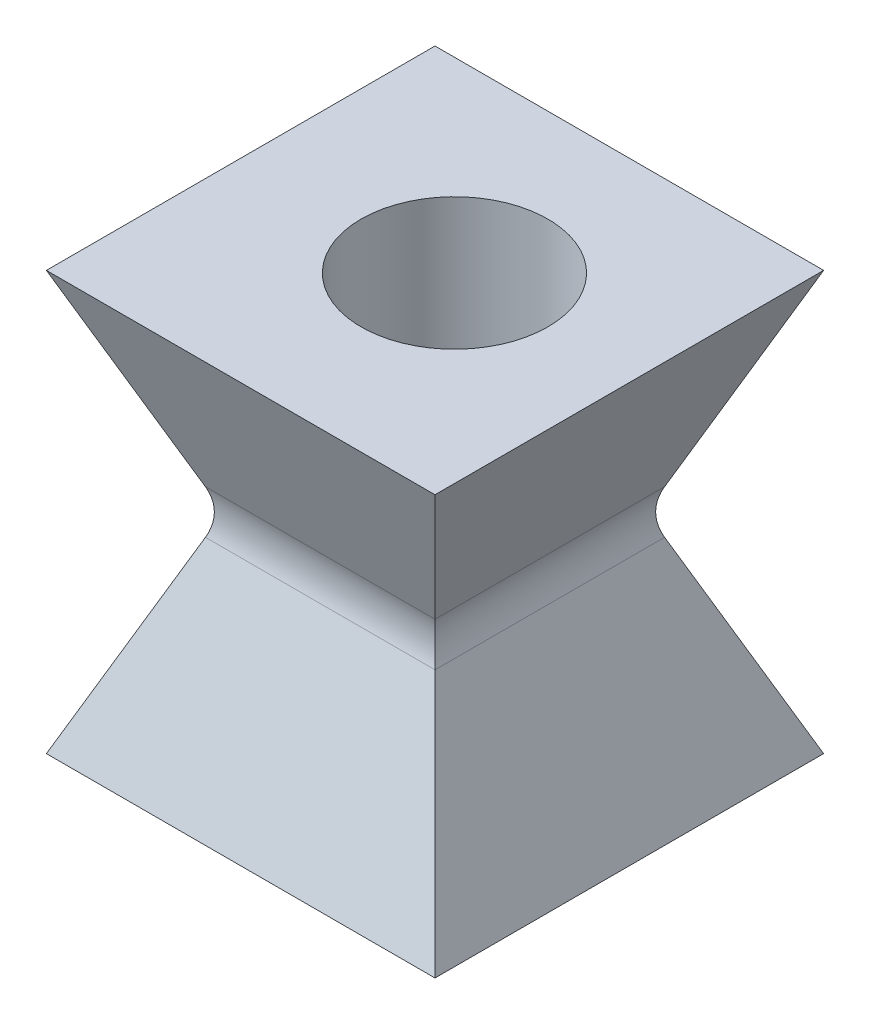
from build123d import *

# Parameters (mm, degrees)
BOSS_EXTRU_1_DEPTH           = 104
ENL_V_MAT_EXTRU_1_DEPTH      = 143.789209242
ENL_V_MAT_EXTRU_1_DEPTH_BACK = 143.789209242
ESQUISSE4_R                  = 25
ENL_V_MAT_EXTRU_2_DEPTH      = 173.617375359
CONG_1_R                     = 15


with BuildPart() as part:
    # Esquisse1 → Boss.-Extru.1 (new body)
    with BuildSketch(Plane.XY):
        Polygon((80.229410292, 56), (-23.770589708, 56), (0, 0), (56.458820585, 0), align=None)
        Polygon((-23.770589708, -56), (0, 0), (56.458820585, 0), (80.229410292, -56), align=None)
    extrude(amount=BOSS_EXTRU_1_DEPTH)

    # Esquisse3 → Enlèv. mat.-Extru.1 (cut, two sides: drawn at the far end of the back side and taken through both)
    with BuildSketch(Plane(origin=(0, 0, 0), x_dir=(0, 0, -1), z_dir=(1, 0, 0)).offset(-ENL_V_MAT_EXTRU_1_DEPTH_BACK)):
        Polygon((-23.770589708, 0), (0, 0), (0, 56), align=None)
        Polygon((0, 0), (0, -56), (-23.770589708, 0), align=None)
        Polygon((-104, 0), (-104, 56), (-80.229410292, 0), align=None)
        Polygon((-80.229410292, 0), (-104, 0), (-104, -56), align=None)
    extrude(amount=ENL_V_MAT_EXTRU_1_DEPTH + ENL_V_MAT_EXTRU_1_DEPTH_BACK, mode=Mode.SUBTRACT)

    # Esquisse4 → Enlèv. mat.-Extru.2 (cut, through all)
    with BuildSketch(Plane(origin=(0, 56, 0), x_dir=(1, 0, 0), z_dir=(0, 1, 0))):
        with Locations(Location((31.437518052, -50, 0), (0, 0, 180))):
            Circle(ESQUISSE4_R)
    extrude(amount=-ENL_V_MAT_EXTRU_2_DEPTH, mode=Mode.SUBTRACT)

    # Congé1
    cong_1_edges = [part.edges().sort_by_distance(p)[0] for p in [
        (56.458820585, 0, 52),
        (0, 0, 52),
        (28.229410292, 0, 23.770589708),
        (28.229410292, 0, 80.229410292),
    ]]
    fillet(cong_1_edges, radius=CONG_1_R)


solid = part.part
